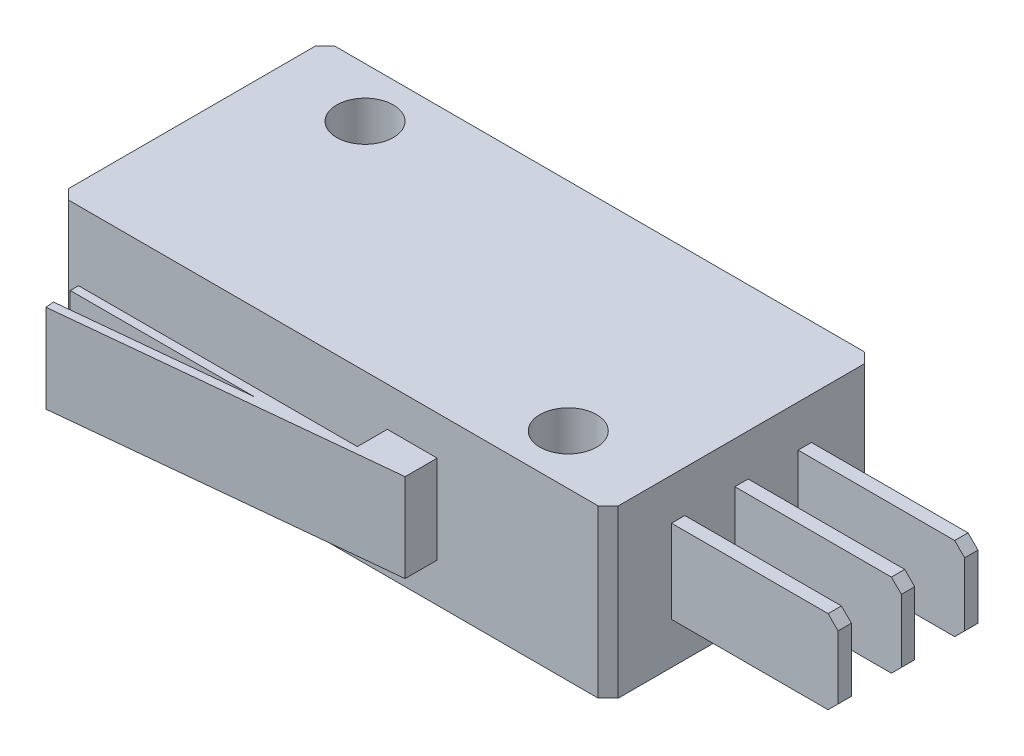
from build123d import *

# Parameters (mm, degrees)
SKETCH_1_W      = 33
SKETCH_1_H      = 16
SKETCH_1_R      = 1.7
EXTRUDE_1_DEPTH = 5
EXTRUDE_2_DEPTH = 2.65
SKETCH_3_W      = 0.8
SKETCH_3_H      = 5
EXTRUDE_3_DEPTH = 10
CHAMFER_1_SIZE  = 0.6


with BuildPart() as part:
    # 草图1 → 凸台-拉伸1 (new, symmetric)
    with BuildSketch(Plane(origin=(0, 0, 0), x_dir=(1, 0, 0), z_dir=(0, 1, 0))):
        Rectangle(SKETCH_1_W, SKETCH_1_H)
        with Locations(Location((-11.1, 5, 0), (0, 0, 270))):
            Circle(SKETCH_1_R, mode=Mode.SUBTRACT)
        with Locations(Location((11.1, -5, 0), (0, 0, 270))):
            Circle(SKETCH_1_R, mode=Mode.SUBTRACT)
    extrude(amount=EXTRUDE_1_DEPTH, both=True)

    # 草图2 → 凸台-拉伸2 (add, symmetric)
    with BuildSketch(Plane(origin=(0, 0, 0), x_dir=(1, 0, 0), z_dir=(0, 1, 0))):
        with BuildLine():
            Line((3.236985687, -9.8), (-13.498945121, -9.8))
            Line((-13.498945121, -9.8), (-13.498945121, -10.3))
            Line((-13.498945121, -10.3), (-2.457771256, -10.3))
            Line((-2.457771256, -10.3), (-13.404349416, -11.402516894))
            Line((-13.404349416, -11.402516894), (-13.354243938, -11.9))
            Line((-13.354243938, -11.9), (6.231752422, -9.92733863))
            Line((6.231752422, -9.92733863), (6.231752422, -4.606941304))
            ThreePointArc((6.231752422, -4.606941304), (4.679221154, -3.232884233), (3.236985687, -4.72229453))
            Line((3.236985687, -4.72229453), (3.236985687, -9.8))
        make_face()
    extrude(amount=EXTRUDE_2_DEPTH, both=True)

    # 草图3 → 凸台-拉伸3 (add)
    with BuildSketch(Plane(origin=(16.5, 0, 0), x_dir=(0, 0, -1), z_dir=(1, 0, 0))):
        with Locations((-3.8, 0)):
            Rectangle(SKETCH_3_W, SKETCH_3_H)
        Rectangle(SKETCH_3_W, SKETCH_3_H)
        with Locations((3.8, 0)):
            Rectangle(SKETCH_3_W, SKETCH_3_H)
    extrude(amount=EXTRUDE_3_DEPTH)

    # 倒角1
    chamfer_1_edges = [part.edges().sort_by_distance(p)[0] for p in [
        (26.5, -2.5, 3.8),
        (26.5, 2.5, 3.8),
        (26.5, -2.5, 0),
        (26.5, 2.5, 0),
        (-16.5, 0, -8),
        (26.5, -2.5, -3.8),
        (16.5, 0, -8),
        (26.5, 2.5, -3.8),
        (16.5, 0, 8),
        (-16.5, 0, 8),
    ]]
    chamfer(chamfer_1_edges, length=CHAMFER_1_SIZE)


solid = part.part
